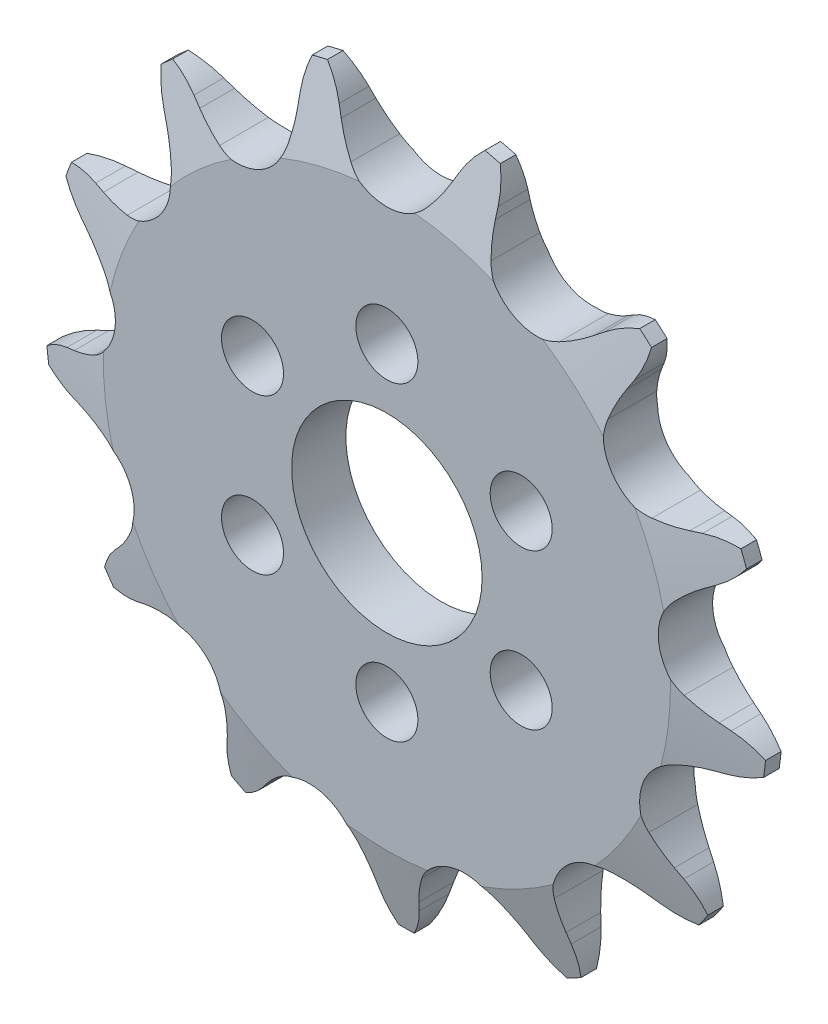
from build123d import *

# Parameters (mm, degrees)
CUT_EXTRUDE1_DEPTH      = 53.351870728
CIRPATTERN1_COUNT       = 13
CUT_EXTRUDE2_DEPTH      = 53.2238536
CUT_EXTRUDE2_DEPTH_BACK = 53.2238536
SKETCH3_OUTSIDE_W       = 96.334
SKETCH3_OUTSIDE_H       = 95.805
SKETCH3_OUTSIDE_R       = 36.957
SKETCH3_OUTSIDE_R_2     = 9.75
SKETCH4_R               = 3.175
CUT_EXTRUDE3_DEPTH      = 53.432602108


with BuildPart() as part:
    # Sketch1 → Revolve1 (revolve)
    with BuildSketch(Plane(origin=(0, 0, 0), x_dir=(0, 0, -1), z_dir=(1, 0, 0)), mode=Mode.PRIVATE) as revolve1_sk:
        Polygon((2.778125, 0), (-2.778125, 0), (-2.778125, 29.028703417), (-0.79375, 36.966203417), (0.79375, 36.966203417), (2.778125, 29.028703417), align=None)
    revolve(revolve1_sk.sketch.rotate(Axis((0, 0, -2.778125), (0, 0, 1)), 90), axis=Axis((0, 0, -2.778125), (0, 0, 1)))

    # Sketch0 → Cut-Extrude1 (cut, symmetric)
    with BuildSketch(Plane.XY):
        with BuildLine():
            Line((13.972225644, -31.053101995), (13.299230952, -30.244466052))
            ThreePointArc((13.299230952, -30.244466052), (12.21448788, -29.08902118), (10.999745816, -28.071120349))
            ThreePointArc((10.999745816, -28.071120349), (6.706579881, -27.209664179), (3.305508878, -29.967579427))
            ThreePointArc((3.305508878, -29.967579427), (2.702950301, -31.433404637), (2.279420017, -32.960605502))
            Line((2.279420017, -32.960605502), (2.059304673, -33.989373298))
            ThreePointArc((2.059304673, -33.989373298), (-1.583510718, -39.32570906), (-7.921697375, -40.58028996))
            ThreePointArc((-7.921697375, -40.58028996), (9.894807697, -40.144812905), (25.872915747, -32.250665936))
            ThreePointArc((25.872915747, -32.250665936), (19.677697364, -34.085291927), (13.972225644, -31.053101995))
        make_face()
    cut_extrude1 = extrude(amount=CUT_EXTRUDE1_DEPTH, both=True, mode=Mode.SUBTRACT)

    # CirPattern1: Cut-Extrude1 ×13 about axis
    cirpattern1_axis = Axis((0, 0, 0), (0, 0, 1))
    for i in range(1, CIRPATTERN1_COUNT):
        add(cut_extrude1.rotate(cirpattern1_axis, i * 360 / CIRPATTERN1_COUNT), mode=Mode.SUBTRACT)

    # Sketch3 outside → Cut-Extrude2 (cut, two sides: drawn at the far end of the back side and taken through both)
    # profile 1 of 2: a face of its own
    with BuildSketch(Plane.XY.offset(-CUT_EXTRUDE2_DEPTH_BACK)):
        with Locations((0, -0.4455)):
            Rectangle(SKETCH3_OUTSIDE_W, SKETCH3_OUTSIDE_H)
        Circle(SKETCH3_OUTSIDE_R, mode=Mode.SUBTRACT)
    # profile 2 of 2: a face of its own
    with BuildSketch(Plane.XY.offset(-CUT_EXTRUDE2_DEPTH_BACK)):
        Circle(SKETCH3_OUTSIDE_R_2)
    extrude(amount=CUT_EXTRUDE2_DEPTH + CUT_EXTRUDE2_DEPTH_BACK, mode=Mode.SUBTRACT)

    # Sketch4 → Cut-Extrude3 (cut, through all)
    with BuildSketch(Plane(origin=(0, 0, -2.778125), x_dir=(-1, 0, 0), z_dir=(0, 0, -1))):
        with Locations((0, 15.875)):
            Circle(SKETCH4_R)
        with Locations((13.748153285, 7.9375)):
            Circle(SKETCH4_R)
        with Locations((13.748153285, -7.9375)):
            Circle(SKETCH4_R)
        with Locations((0, -15.875)):
            Circle(SKETCH4_R)
        with Locations((-13.748153285, -7.9375)):
            Circle(SKETCH4_R)
        with Locations((-13.748153285, 7.9375)):
            Circle(SKETCH4_R)
    extrude(amount=-CUT_EXTRUDE3_DEPTH, mode=Mode.SUBTRACT)


solid = part.part
